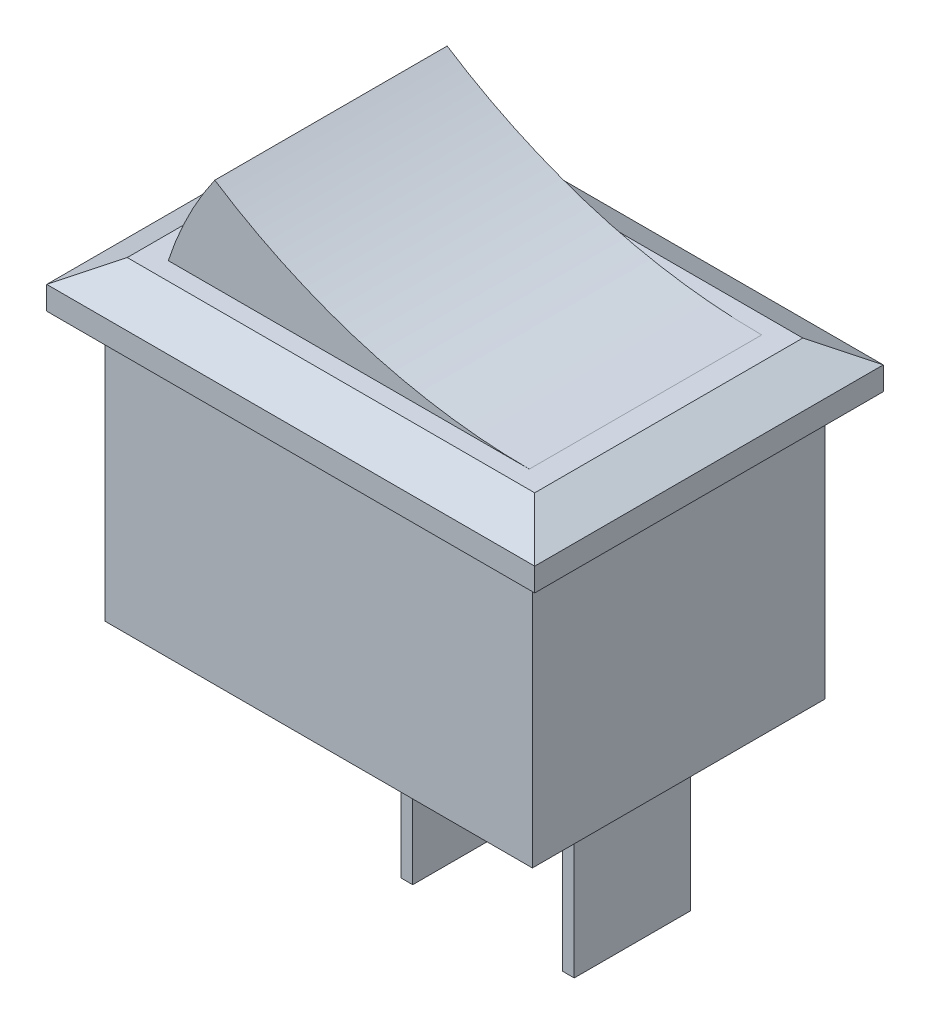
from build123d import *
from OCP.BRepFilletAPI import BRepFilletAPI_MakeChamfer

# Parameters (mm, degrees)
SKETCH1_W             = 21
SKETCH1_H             = 15
BOSS_EXTRUDE1_DEPTH   = 2
CHAMFER1_SIZE         = 1
CHAMFER1_SIZE2        = 1.732050808
BOSS_EXTRUDE2_DEPTH   = 5
SKETCH3_W             = 18.4
SKETCH3_H             = 12.6
BOSS_EXTRUDE3_DEPTH   = 11.5
SKETCH4_W             = 0.5
SKETCH4_H             = 5
BOSS_EXTRUDE4_DEPTH   = 7
BOSS_EXTRUDE4_2_DEPTH = 7


with BuildPart() as part:
    # Sketch1 → Boss-Extrude1 (new body)
    with BuildSketch(Plane(origin=(0, 0, 0), x_dir=(1, 0, 0), z_dir=(0, 1, 0))):
        Rectangle(SKETCH1_W, SKETCH1_H)
    extrude(amount=BOSS_EXTRUDE1_DEPTH)

    # Chamfer1: one chamfer whose edges measure the first distance from different faces: ONE call of the kernel's chamfer builder (chamfer() names one face for all edges)
    chamfer1_edges_1 = [part.edges().sort_by_distance(p)[0] for p in [
        (10.5, 2, 0),
    ]]
    chamfer1_side_1 = [part.faces().sort_by_distance(p)[0] for p in [
        (10.5, 1, 0),
    ]]
    chamfer1_edges_2 = [part.edges().sort_by_distance(p)[0] for p in [
        (0, 2, -7.5),
    ]]
    chamfer1_side_2 = [part.faces().sort_by_distance(p)[0] for p in [
        (0, 1, -7.5),
    ]]
    chamfer1_edges_3 = [part.edges().sort_by_distance(p)[0] for p in [
        (-10.5, 2, 0),
    ]]
    chamfer1_side_3 = [part.faces().sort_by_distance(p)[0] for p in [
        (-10.5, 1, 0),
    ]]
    chamfer1_edges_4 = [part.edges().sort_by_distance(p)[0] for p in [
        (0, 2, 7.5),
    ]]
    chamfer1_side_4 = [part.faces().sort_by_distance(p)[0] for p in [
        (0, 1, 7.5),
    ]]
    chamfer1 = BRepFilletAPI_MakeChamfer(part.part.solid().wrapped)
    for e in chamfer1_edges_1:
        chamfer1.Add(CHAMFER1_SIZE, CHAMFER1_SIZE2, e.wrapped, chamfer1_side_1[0].wrapped)  # the first distance lies on this face
    for e in chamfer1_edges_2:
        chamfer1.Add(CHAMFER1_SIZE, CHAMFER1_SIZE2, e.wrapped, chamfer1_side_2[0].wrapped)  # the first distance lies on this face
    for e in chamfer1_edges_3:
        chamfer1.Add(CHAMFER1_SIZE, CHAMFER1_SIZE2, e.wrapped, chamfer1_side_3[0].wrapped)  # the first distance lies on this face
    for e in chamfer1_edges_4:
        chamfer1.Add(CHAMFER1_SIZE, CHAMFER1_SIZE2, e.wrapped, chamfer1_side_4[0].wrapped)  # the first distance lies on this face
    add(Compound.cast(chamfer1.Shape()), mode=Mode.REPLACE)

    # Sketch3 → Boss-Extrude3 (add)
    with BuildSketch(Plane.XZ):
        Rectangle(SKETCH3_W, SKETCH3_H)
    extrude(amount=BOSS_EXTRUDE3_DEPTH)


with BuildPart() as body_2:
    # Sketch2 → Boss-Extrude2 (new, symmetric)
    with BuildSketch(Plane.XY):
        with BuildLine():
            Line((-7.767949192, 2), (7.767949192, 2))
            ThreePointArc((7.767949192, 2), (0.710673778, 3.020927416), (-5.767949192, 6))
            ThreePointArc((-5.767949192, 6), (-6.917857896, 4.074954352), (-7.767949192, 2))
        make_face()
    extrude(amount=BOSS_EXTRUDE2_DEPTH, both=True)


with BuildPart() as body_3:
    # Sketch4 → Boss-Extrude4 (new body)
    with BuildSketch(Plane.XZ.offset(11.5)):
        Rectangle(SKETCH4_W, SKETCH4_H)
    extrude(amount=BOSS_EXTRUDE4_DEPTH)


with BuildPart() as body_4:
    # Sketch4 → Boss-Extrude4 2 (new body)
    with BuildSketch(Plane.XZ.offset(11.5)):
        with Locations((6.95, 0)):
            Rectangle(SKETCH4_W, SKETCH4_H)
    extrude(amount=BOSS_EXTRUDE4_2_DEPTH)


solid = Compound([part.part, body_2.part, body_3.part, body_4.part])
